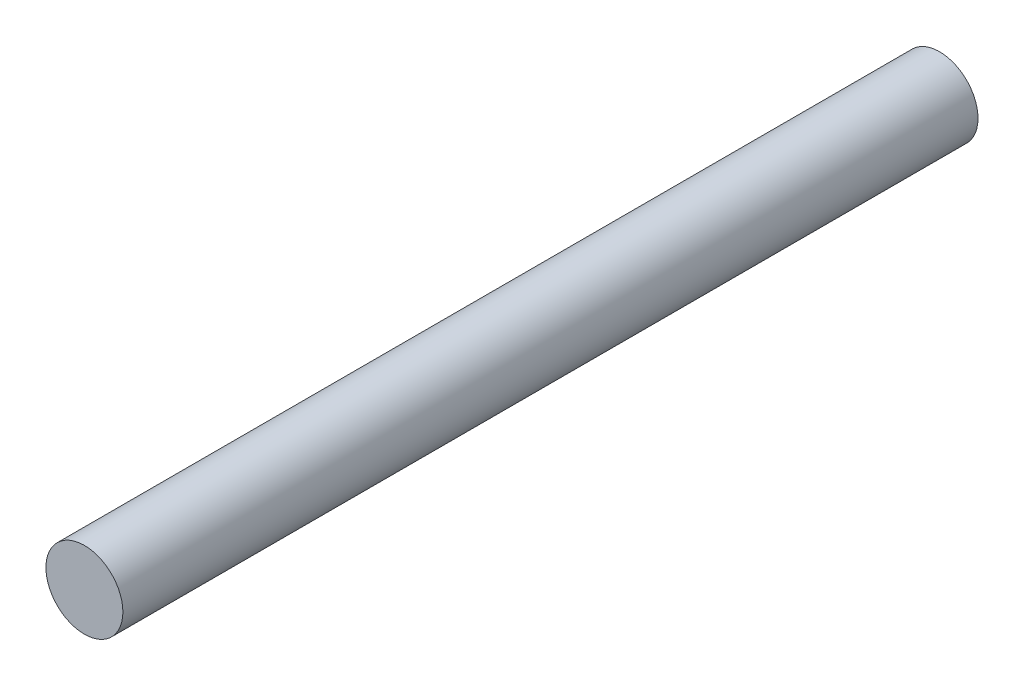
from build123d import *

# Parameters (mm, degrees)
ESQUISSE2_R        = 2
BOSS_EXTRU_1_DEPTH = 22.225


with BuildPart() as part:
    # Esquisse2 → Boss.-Extru.1 (new, symmetric)
    with BuildSketch(Plane.XY):
        Circle(ESQUISSE2_R)
    extrude(amount=BOSS_EXTRU_1_DEPTH, both=True)


solid = part.part
